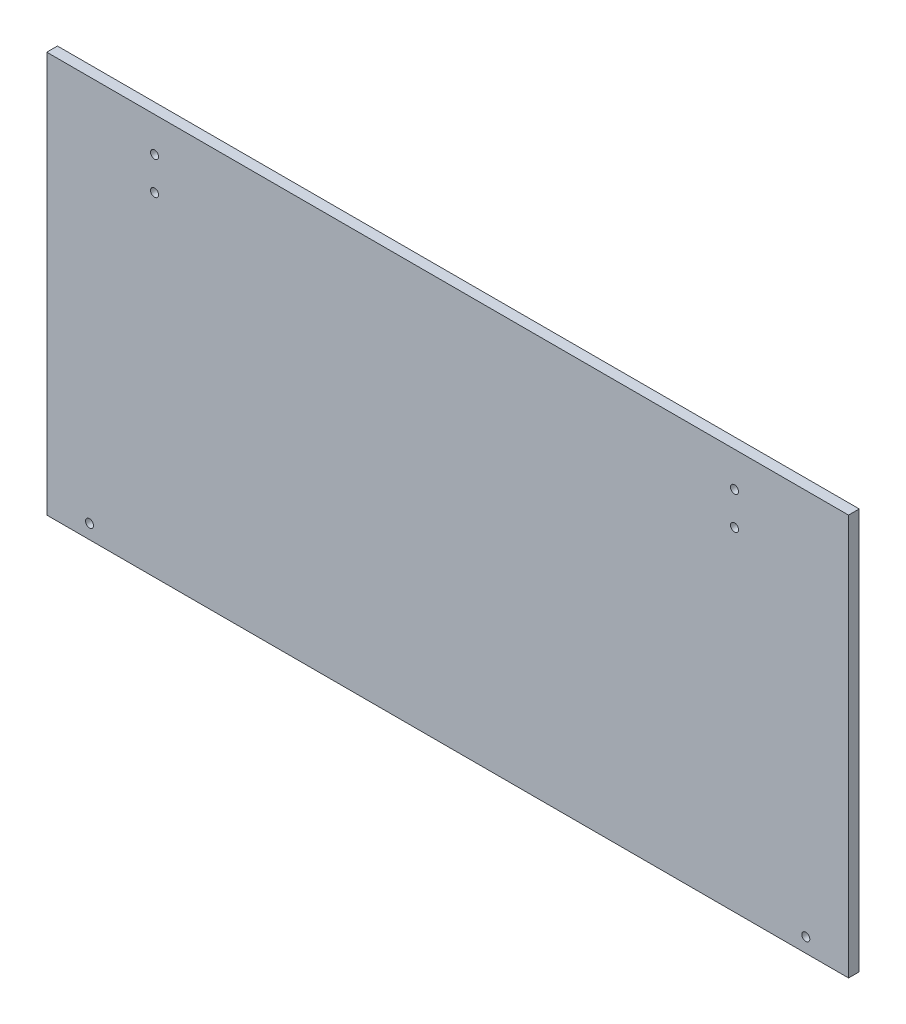
from build123d import *

# Parameters (mm, degrees)
SCHIZZO1_W                   = 450
SCHIZZO1_H                   = 225
ESTRUSIONE_ESTRUSIONE1_DEPTH = 6
SCHIZZO2_R                   = 2.25
TAGLIO_ESTRUSIONE1_DEPTH     = 10
SCHIZZO3_R                   = 2.25
TAGLIO_ESTRUSIONE2_DEPTH     = 10


with BuildPart() as part:
    # Schizzo1 → Estrusione-Estrusione1 (new body)
    with BuildSketch(Plane.XY):
        Rectangle(SCHIZZO1_W, SCHIZZO1_H)
    extrude(amount=ESTRUSIONE_ESTRUSIONE1_DEPTH)

    # Schizzo2 → Taglio-Estrusione1 (cut)
    with BuildSketch(Plane.XY.offset(6)):
        with Locations((-164.5, 93)):
            Circle(SCHIZZO2_R)
        with Locations((-164.5, 74.5)):
            Circle(SCHIZZO2_R)
        with Locations((161, 93)):
            Circle(SCHIZZO2_R)
        with Locations((161, 74.5)):
            Circle(SCHIZZO2_R)
    extrude(amount=-TAGLIO_ESTRUSIONE1_DEPTH, mode=Mode.SUBTRACT)

    # Schizzo3 → Taglio-Estrusione2 (cut)
    with BuildSketch(Plane.XY.offset(6)):
        with Locations((-201, -104.5)):
            Circle(SCHIZZO3_R)
        with Locations((201, -104.5)):
            Circle(SCHIZZO3_R)
    extrude(amount=-TAGLIO_ESTRUSIONE2_DEPTH, mode=Mode.SUBTRACT)


solid = part.part
